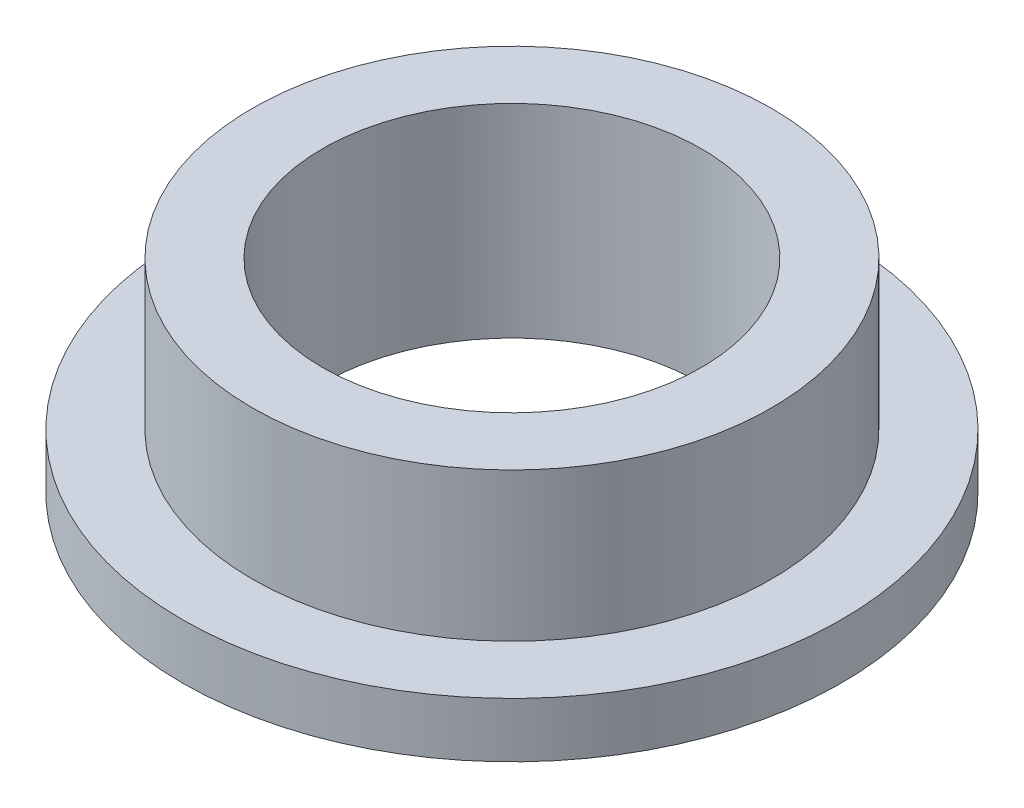
from build123d import *

# Parameters (mm, degrees)
SKETCH1_R           = 6
BOSS_EXTRUDE1_DEPTH = 1
SKETCH2_R           = 4.725
BOSS_EXTRUDE2_DEPTH = 2.7
SKETCH3_R           = 3.45
CUT_EXTRUDE1_DEPTH  = 10.256889326


with BuildPart() as part:
    # Sketch1 → Boss-Extrude1 (new body)
    with BuildSketch(Plane(origin=(0, 0, 0), x_dir=(1, 0, 0), z_dir=(0, 1, 0))):
        with Locations(Location((0, 0, 0), (0, 0, 270))):
            Circle(SKETCH1_R)
    extrude(amount=BOSS_EXTRUDE1_DEPTH)

    # Sketch2 → Boss-Extrude2 (add)
    with BuildSketch(Plane(origin=(0, 1, 0), x_dir=(1, 0, 0), z_dir=(0, 1, 0))):
        with Locations(Location((0, 0, 0), (0, 0, 90))):
            Circle(SKETCH2_R)
    extrude(amount=BOSS_EXTRUDE2_DEPTH)

    # Sketch3 → Cut-Extrude1 (cut, through all)
    with BuildSketch(Plane(origin=(0, 3.7, 0), x_dir=(1, 0, 0), z_dir=(0, 1, 0))):
        with Locations(Location((0, 0, 0), (0, 0, 270))):
            Circle(SKETCH3_R)
    extrude(amount=-CUT_EXTRUDE1_DEPTH, mode=Mode.SUBTRACT)


solid = part.part
